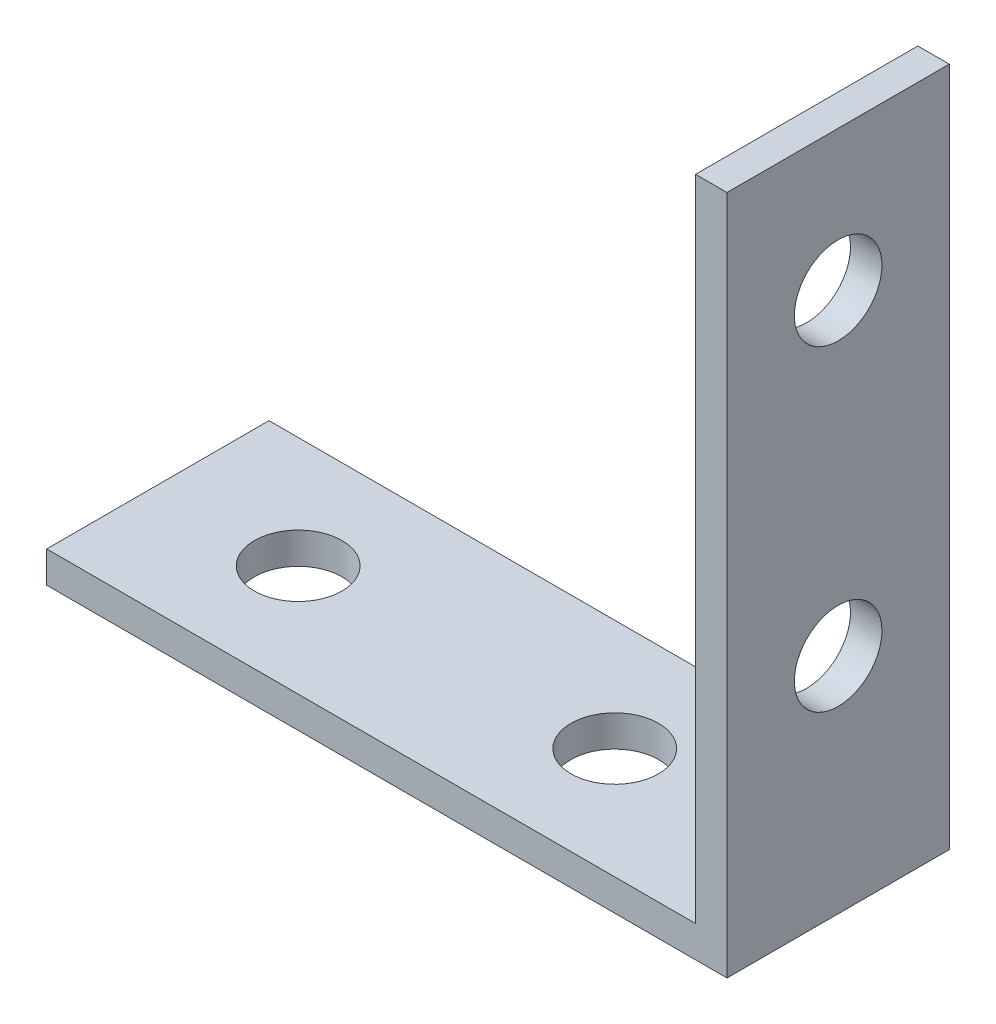
from build123d import *

# Parameters (mm, degrees)
SKETCH1_W           = 38.481
SKETCH1_H           = 38.481
BOSS_EXTRUDE1_DEPTH = 12.573
SKETCH2_W           = 36.703
SKETCH2_H           = 36.703
CUT_EXTRUDE1_DEPTH  = 56.853872301
SKETCH3_R           = 2.4765
CUT_EXTRUDE2_DEPTH  = 55.644102143


with BuildPart() as part:
    # Sketch1 → Boss-Extrude1 (new body)
    with BuildSketch(Plane.XY):
        with Locations((19.2405, 19.2405)):
            Rectangle(SKETCH1_W, SKETCH1_H)
    extrude(amount=BOSS_EXTRUDE1_DEPTH)

    # Sketch2 → Cut-Extrude1 (cut, through all)
    with BuildSketch(Plane.XY.offset(12.573)):
        with Locations((18.3515, 20.1295)):
            Rectangle(SKETCH2_W, SKETCH2_H)
    extrude(amount=-CUT_EXTRUDE1_DEPTH, mode=Mode.SUBTRACT)

    # Sketch3 → Cut-Extrude2 (cut, through all)
    with BuildSketch(Plane.ZY.offset(-36.703)):
        with Locations(Location((6.2865, 12.6365, 0), (0, 0, 270))):
            Circle(SKETCH3_R)
        with Locations(Location((6.2865, 30.5435, 0), (0, 0, 270))):
            Circle(SKETCH3_R)
    cut_extrude2 = extrude(amount=-CUT_EXTRUDE2_DEPTH, mode=Mode.SUBTRACT)

    # Mirror1: Cut-Extrude2 across plane
    add(cut_extrude2.mirror(Plane(origin=(19.2405, 19.2405, 0), x_dir=(0, 0, 1), z_dir=(0.7071067811865389, 0.7071067811865561, 0))), mode=Mode.SUBTRACT)


solid = part.part
